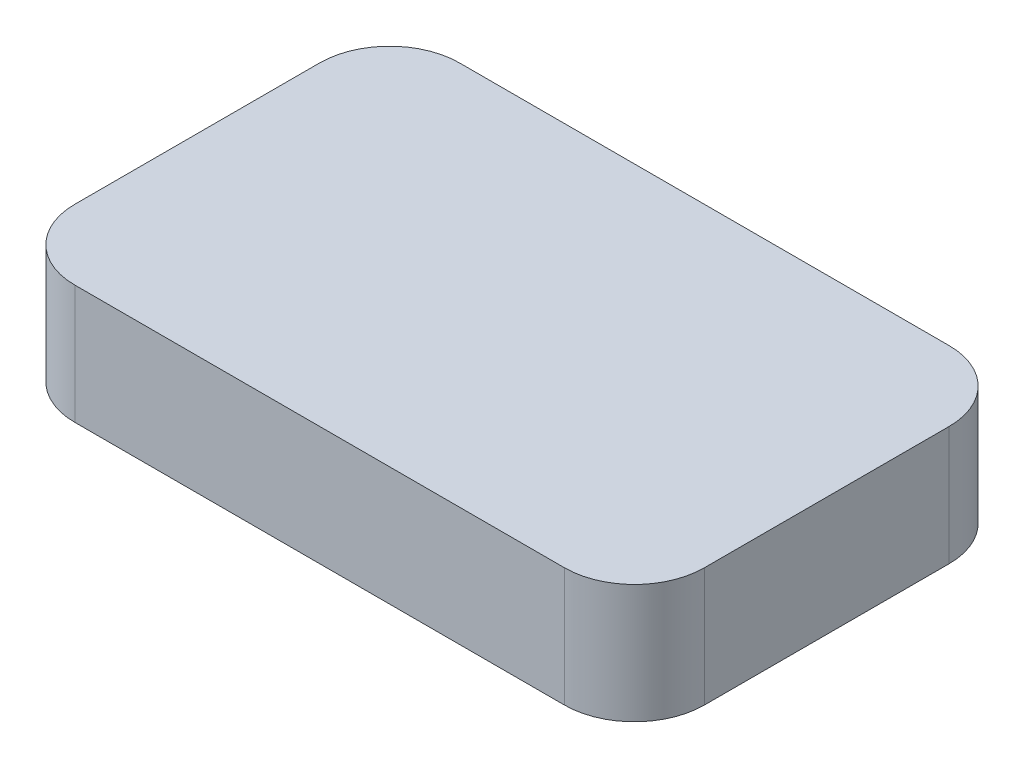
from build123d import *

# Parameters (mm, degrees)
BOSS_EXTRUDE1_DEPTH = 17


with BuildPart() as part:
    # Sketch1 → Boss-Extrude1 (new body)
    with BuildSketch(Plane(origin=(0, 0, 0), x_dir=(1, 0, 0), z_dir=(0, 1, 0))):
        with BuildLine():
            Line((-35, 27.5), (35, 27.5))
            ThreePointArc((35, 27.5), (42.071067812, 24.571067812), (45, 17.5))
            Line((45, 17.5), (45, -17.5))
            ThreePointArc((45, -17.5), (42.071067812, -24.571067812), (35, -27.5))
            Line((35, -27.5), (-35, -27.5))
            ThreePointArc((-35, -27.5), (-42.071067812, -24.571067812), (-45, -17.5))
            Line((-45, -17.5), (-45, 17.5))
            ThreePointArc((-45, 17.5), (-42.071067812, 24.571067812), (-35, 27.5))
        make_face()
    extrude(amount=BOSS_EXTRUDE1_DEPTH)


solid = part.part
